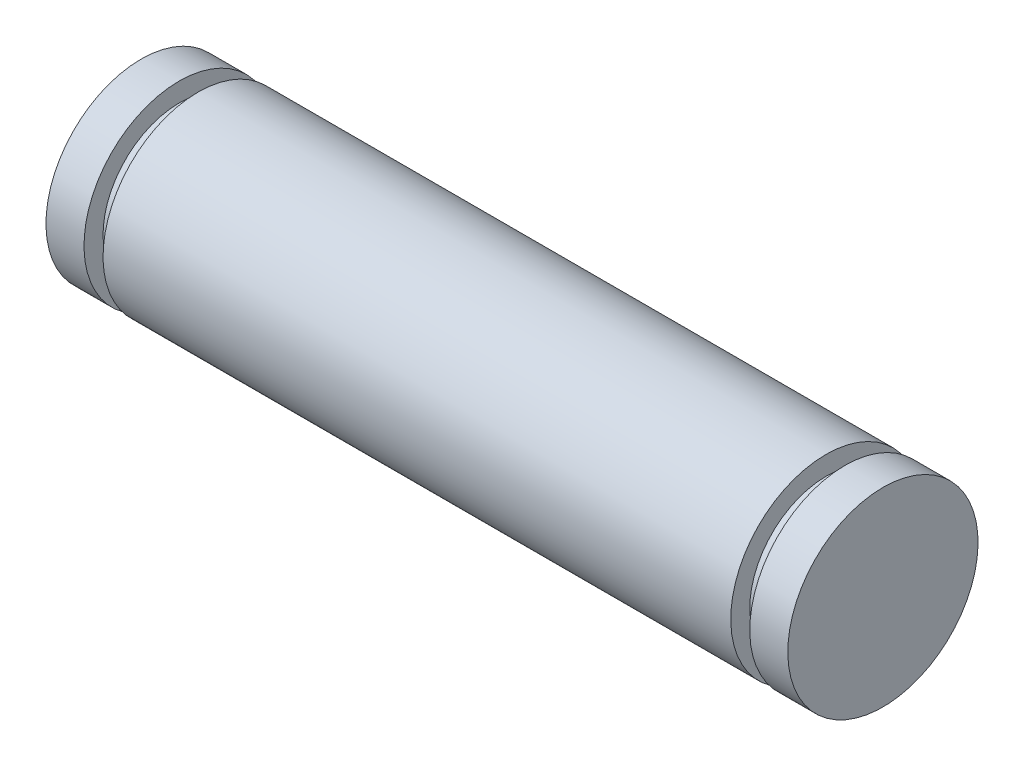
from build123d import *


with BuildPart() as part:
    # Sketch2 → Revolve1 (revolve)
    with BuildSketch(Plane.XY):
        Polygon((0, 2.5), (0, 0), (-19.5, 0), (-19.5, 2.5), (-18.5, 2.5), (-18.5, 2), (-18, 2), (-18, 2.5), (-1.5, 2.5), (-1.5, 2), (-1, 2), (-1, 2.5), align=None)
    revolve(axis=Axis((0, 0, 0), (-1, 0, 0)))


solid = part.part
